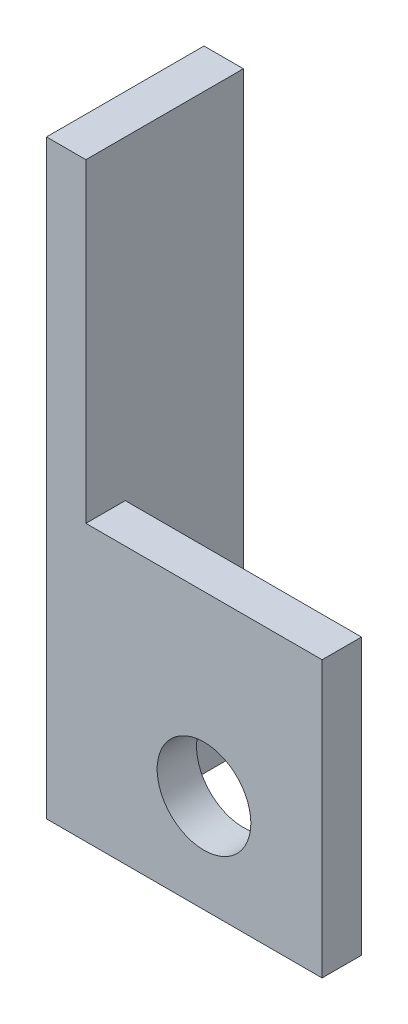
from build123d import *

# Parameters (mm, degrees)
BOSS_EXTRUDE1_DEPTH = 1
SKETCH2_W           = 1
SKETCH2_H           = 15
BOSS_EXTRUDE2_DEPTH = 3
SKETCH4_R           = 1.190073959
CUT_EXTRUDE1_DEPTH  = 3


with BuildPart() as part:
    # Sketch1 → Boss-Extrude1 (new body)
    with BuildSketch(Plane.XY):
        Polygon((0, 0), (7, 0), (7, 7), (1, 7), (1, 15), (0, 15), align=None)
    extrude(amount=BOSS_EXTRUDE1_DEPTH)

    # Sketch2 → Boss-Extrude2 (add)
    with BuildSketch(Plane(origin=(0, 0, 0), x_dir=(-1, 0, 0), z_dir=(0, 0, -1))):
        with Locations((-0.5, 7.5)):
            Rectangle(SKETCH2_W, SKETCH2_H)
    extrude(amount=BOSS_EXTRUDE2_DEPTH)

    # Sketch4 → Cut-Extrude1 (cut)
    with BuildSketch(Plane.XY.offset(1)):
        with Locations((4, 2.5)):
            Circle(SKETCH4_R)
    extrude(amount=-CUT_EXTRUDE1_DEPTH, mode=Mode.SUBTRACT)


solid = part.part
